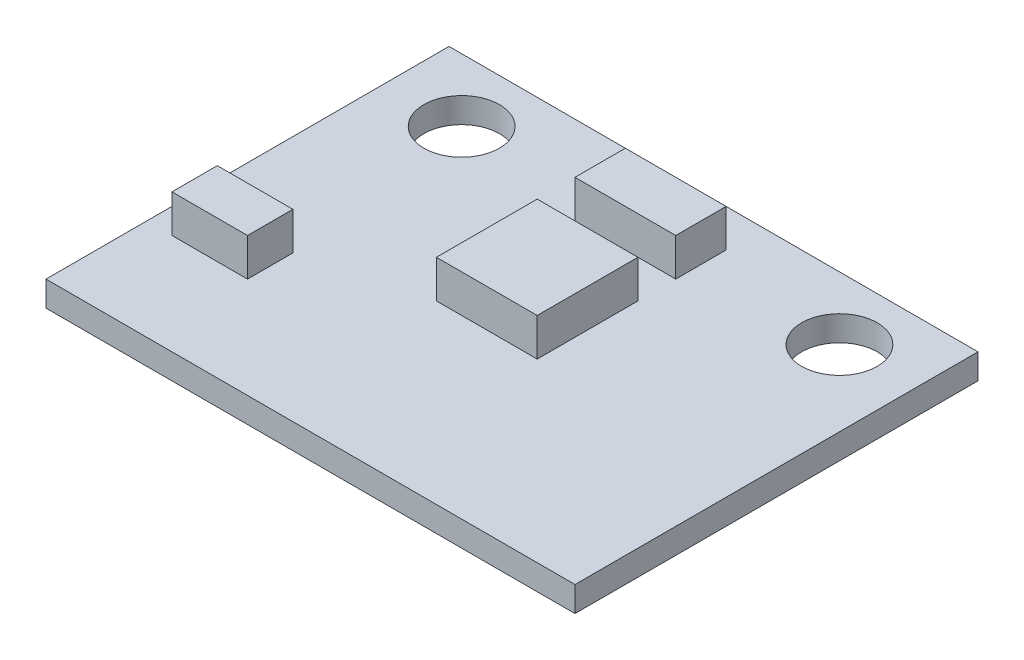
from build123d import *

# Parameters (mm, degrees)
SKETCH1_W        = 21
SKETCH1_H        = 16
SKETCH1_R        = 1.5
PCB_DEPTH        = 1
SKETCH2_W        = 4
SKETCH2_H        = 4
SKETCH2_W_2      = 3
SKETCH2_H_2      = 1.8
COMPONENTS_DEPTH = 1.5
SKETCH3_W        = 4
SKETCH3_H        = 2
CAPACITOR_DEPTH  = 1.5


with BuildPart() as part:
    # Sketch1 → PCB (new body)
    with BuildSketch(Plane(origin=(0, 0, 0), x_dir=(1, 0, 0), z_dir=(0, 1, 0))):
        Rectangle(SKETCH1_W, SKETCH1_H)
        with Locations(Location((-7.5, 5.5, 0), (0, 0, 270))):
            Circle(SKETCH1_R, mode=Mode.SUBTRACT)
        with Locations(Location((7.5, 5.5, 0), (0, 0, 270))):
            Circle(SKETCH1_R, mode=Mode.SUBTRACT)
    extrude(amount=PCB_DEPTH)

    # Sketch2 → Components (add)
    with BuildSketch(Plane(origin=(0, 1, 0), x_dir=(1, 0, 0), z_dir=(0, 1, 0))):
        with Locations((0, 1)):
            Rectangle(SKETCH2_W, SKETCH2_H)
        with Locations((-8, -3.1)):
            Rectangle(SKETCH2_W_2, SKETCH2_H_2)
    extrude(amount=COMPONENTS_DEPTH)

    # Sketch3 → Capacitor (add)
    with BuildSketch(Plane(origin=(0, 1, 0), x_dir=(1, 0, 0), z_dir=(0, 1, 0))):
        with Locations((0, 5.5)):
            Rectangle(SKETCH3_W, SKETCH3_H)
    extrude(amount=CAPACITOR_DEPTH)


solid = part.part
